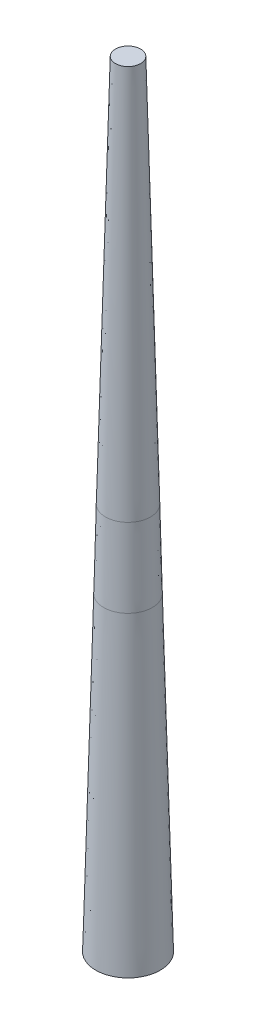
from build123d import *


with BuildPart() as part:
    # Croquis1 → Revolución1 (revolve)
    with BuildSketch(Plane(origin=(0, 0, 0), x_dir=(0, 0, -1), z_dir=(1, 0, 0))):
        Polygon((0, 0), (3.25, 0), (5.8, -100), (6.26, -120), (8.3, -200), (0, -200), align=None)
    revolve(axis=Axis((0, -200, 0), (0, 1, 0)))


solid = part.part
